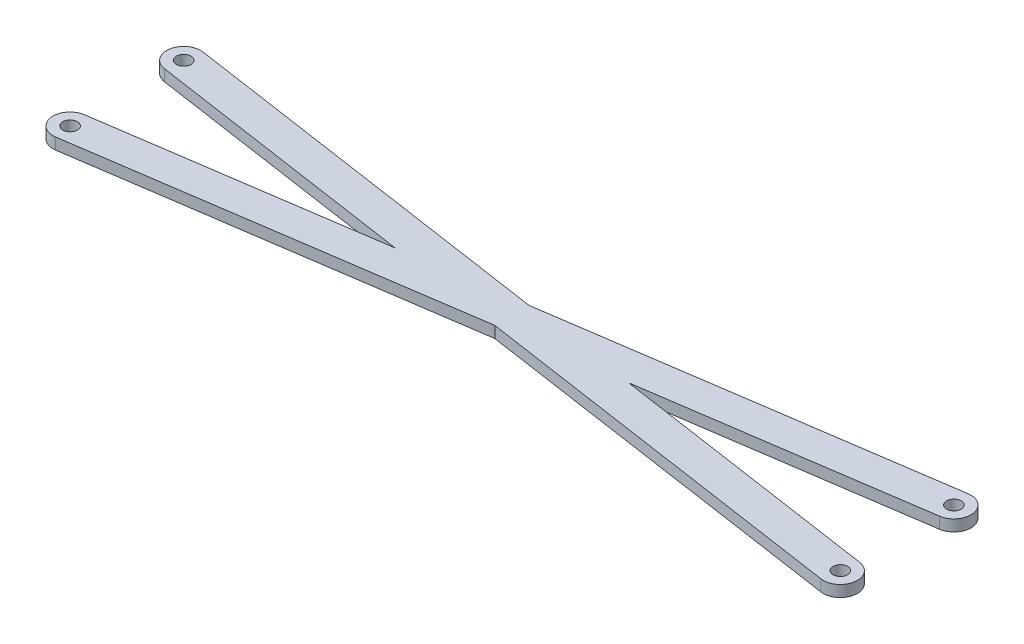
from build123d import *

# Parameters (mm, degrees)
BOSS_EXTRUDE1_DEPTH = 3.175
SKETCH2_R           = 2.032
CUT_EXTRUDE1_DEPTH  = 115.695104393


with BuildPart() as part:
    # Sketch1 → Boss-Extrude1 (new body)
    with BuildSketch(Plane(origin=(0, 0, 0), x_dir=(1, 0, 0), z_dir=(0, 1, 0))):
        with BuildLine():
            Line((-108.172056186, -12.373235341), (-32.483719252, -1.209763817))
            Line((-32.483719252, -1.209763817), (-108.172056172, 9.953707462))
            ThreePointArc((-108.172056172, 9.953707462), (-112.188668788, 15.360151236), (-106.782225129, 19.376764008))
            Line((-106.782225129, 19.376764008), (0.155358302, 3.604259421))
            Line((0.155358302, 3.604259421), (107.092941684, 19.376764345))
            ThreePointArc((107.092941684, 19.376764345), (112.499387579, 15.360153144), (108.482775156, 9.953708157))
            Line((108.482775156, 9.953708157), (32.794435872, -1.209763714))
            Line((32.794435872, -1.209763714), (108.482775141, -12.373235339))
            ThreePointArc((108.482775141, -12.373235339), (112.499387585, -17.779680288), (107.092941749, -21.796291538))
            Line((107.092941749, -21.796291538), (0.155358318, -6.023786952))
            Line((0.155358318, -6.023786952), (-106.782225064, -21.796291875))
            ThreePointArc((-106.782225064, -21.796291875), (-112.188668782, -17.779679153), (-108.172056186, -12.373235341))
        make_face()
    extrude(amount=BOSS_EXTRUDE1_DEPTH)

    # Sketch2 → Cut-Extrude1 (cut, through all)
    with BuildSketch(Plane(origin=(0, 3.175, 0), x_dir=(1, 0, 0), z_dir=(0, 1, 0))):
        with Locations(Location((-107.477140515, 14.665235715, 0), (0, 0, 270))):
            Circle(SKETCH2_R)
        with Locations(Location((-107.477140515, -17.084763592, 0), (0, 0, 270))):
            Circle(SKETCH2_R)
        with Locations(Location((107.787859485, 14.665236408, 0), (0, 0, 270))):
            Circle(SKETCH2_R)
        with Locations(Location((107.787859485, -17.084763592, 0), (0, 0, 270))):
            Circle(SKETCH2_R)
    extrude(amount=-CUT_EXTRUDE1_DEPTH, mode=Mode.SUBTRACT)


solid = part.part
